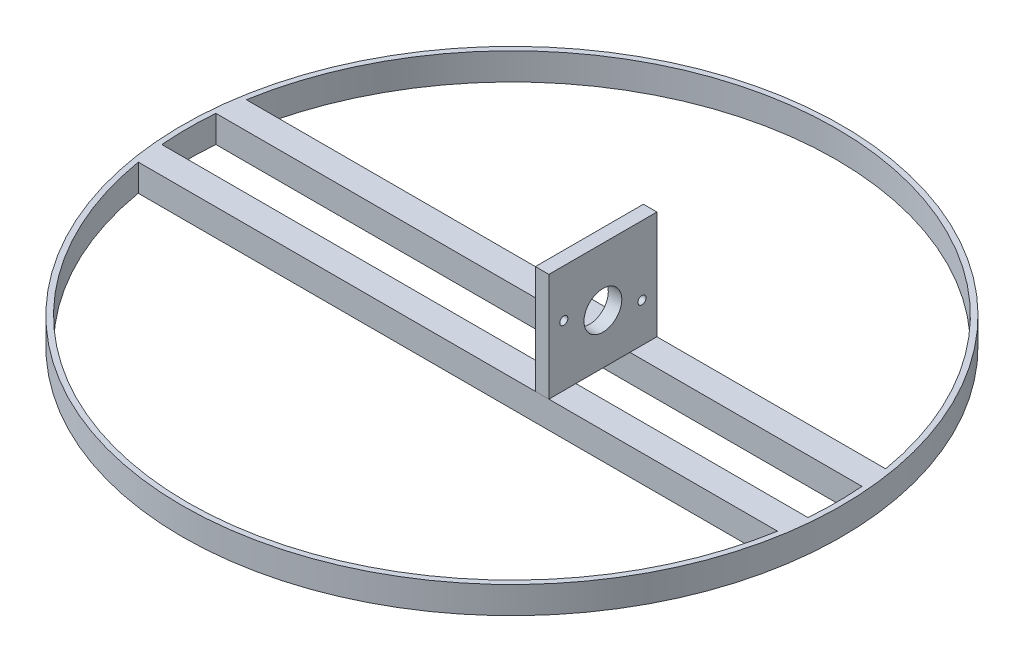
from build123d import *

# Parameters (mm, degrees)
SKETCH1_R               = 122
SKETCH1_R_2             = 120
BOSS_EXTRUDE1_DEPTH     = 10
SKETCH2_W               = 10
SKETCH2_H               = 10
BOSS_EXTRUDE2_DEPTH     = 300
CUT_EXTRUDE5_DEPTH      = 374.854124119
CUT_EXTRUDE5_DEPTH_BACK = 374.854124119
SKETCH3_OUTSIDE_W       = 379.366
SKETCH3_OUTSIDE_H       = 323.366
SKETCH3_OUTSIDE_R       = 122
BOSS_EXTRUDE3_START     = -105
SKETCH4_W               = 40
SKETCH4_H               = 40
SKETCH4_R               = 1.5
SKETCH4_R_2             = 7
BOSS_EXTRUDE3_DEPTH     = 5


with BuildPart() as part:
    # Sketch1 → Boss-Extrude1 (new body)
    with BuildSketch(Plane(origin=(0, 0, 0), x_dir=(1, 0, 0), z_dir=(0, 1, 0))):
        with Locations(Location((-133.671737878, -100.860732568, 0), (0, 0, 270))):
            Circle(SKETCH1_R)
        with Locations(Location((-133.671737878, -100.860732568, 0), (0, 0, 270))):
            Circle(SKETCH1_R_2, mode=Mode.SUBTRACT)
    extrude(amount=BOSS_EXTRUDE1_DEPTH)

    # Sketch2 → Boss-Extrude2 (add)
    with BuildSketch(Plane(origin=(0, 0, 0), x_dir=(0, 0, -1), z_dir=(1, 0, 0))):
        with Locations((-115.860732568, 5)):
            Rectangle(SKETCH2_W, SKETCH2_H)
        with Locations((-85.860732568, 5)):
            Rectangle(SKETCH2_W, SKETCH2_H)
    extrude(amount=-BOSS_EXTRUDE2_DEPTH)

    # Sketch3 outside → Cut-Extrude5 (cut, two sides: drawn at the far end of the back side and taken through both)
    with BuildSketch(Plane(origin=(0, 0, 0), x_dir=(1, 0, 0), z_dir=(0, 1, 0)).offset(-CUT_EXTRUDE5_DEPTH_BACK)):
        with Locations((-150, -100.861)):
            Rectangle(SKETCH3_OUTSIDE_W, SKETCH3_OUTSIDE_H)
        with Locations(Location((-133.671737878, -100.860732568, 0), (0, 0, 270))):
            Circle(SKETCH3_OUTSIDE_R, mode=Mode.SUBTRACT)
    extrude(amount=CUT_EXTRUDE5_DEPTH + CUT_EXTRUDE5_DEPTH_BACK, mode=Mode.SUBTRACT)


with BuildPart() as body_2:
    # Sketch4 → Boss-Extrude3 (new body)
    with BuildSketch(Plane(origin=(0, 0, 0), x_dir=(0, 0, -1), z_dir=(1, 0, 0)).offset(BOSS_EXTRUDE3_START)):
        with Locations((-100.860732568, 30)):
            Rectangle(SKETCH4_W, SKETCH4_H)
        with Locations((-86.38915947, 24.519848777)):
            Circle(SKETCH4_R, mode=Mode.SUBTRACT)
        with Locations((-115.332305667, 32.412521849)):
            Circle(SKETCH4_R, mode=Mode.SUBTRACT)
        with Locations((-100.860732568, 28.466185313)):
            Circle(SKETCH4_R_2, mode=Mode.SUBTRACT)
    extrude(amount=BOSS_EXTRUDE3_DEPTH)


solid = Compound([part.part, body_2.part])
